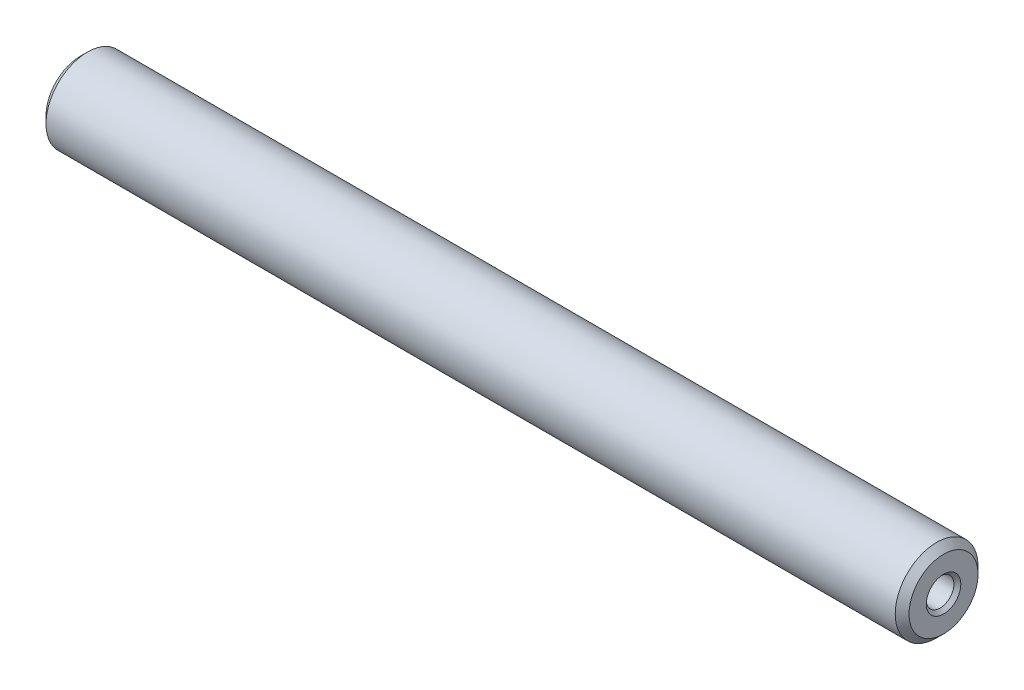
from build123d import *

# Parameters (mm, degrees)
ESQUISSE1_W                                       = 125
ESQUISSE1_H                                       = 6
CHANFREIN1_SIZE                                   = 1
DIAM_TRE_DU_PER_AGE_4_0_4_1_D                     = 4
DIAM_TRE_DU_PER_AGE_4_0_4_1_DEPTH                 = 11
DIAM_TRE_DU_PER_AGE_4_0_4_1_CSINK_D               = 5
DIAM_TRE_DU_PER_AGE_4_0_4_1_CSINK_ANGLE           = 90
DIAM_TRE_DU_PER_AGE_4_0_4_1_TIP                   = 1.201721238
DIAM_TRE_DU_PER_AGE_4_0_4_1_ON_FACE_2_D           = 4
DIAM_TRE_DU_PER_AGE_4_0_4_1_ON_FACE_2_DEPTH       = 11
DIAM_TRE_DU_PER_AGE_4_0_4_1_ON_FACE_2_CSINK_D     = 5
DIAM_TRE_DU_PER_AGE_4_0_4_1_ON_FACE_2_CSINK_ANGLE = 90
DIAM_TRE_DU_PER_AGE_4_0_4_1_ON_FACE_2_TIP         = 1.201721238


with BuildPart() as part:
    # Esquisse1 → Révolution1 (revolve)
    with BuildSketch(Plane.XY, mode=Mode.PRIVATE) as r_volution1_sk:
        with Locations((0, 3)):
            Rectangle(ESQUISSE1_W, ESQUISSE1_H)
    revolve(r_volution1_sk.sketch.rotate(Axis((-35.682971619, 0, 0), (1, 0, 0)), 90), axis=Axis((-35.682971619, 0, 0), (1, 0, 0)))

    # Chanfrein1
    chanfrein1_edges = [part.edges().sort_by_distance(p)[0] for p in [
        (62.5, 0, -6),
        (-62.5, 0, -6),
    ]]
    chamfer(chanfrein1_edges, length=CHANFREIN1_SIZE)

    # Diamètre du perçage Ø4.0 (4)1
    with Locations(Plane(origin=(62.5, 0, 0), x_dir=(0, 0, 1), z_dir=(1, 0, 0))):
        with Locations((0, 0)):
            CounterSinkHole(DIAM_TRE_DU_PER_AGE_4_0_4_1_D / 2, DIAM_TRE_DU_PER_AGE_4_0_4_1_CSINK_D / 2, depth=DIAM_TRE_DU_PER_AGE_4_0_4_1_DEPTH, counter_sink_angle=DIAM_TRE_DU_PER_AGE_4_0_4_1_CSINK_ANGLE)
            with Locations((0, 0, -(DIAM_TRE_DU_PER_AGE_4_0_4_1_DEPTH + DIAM_TRE_DU_PER_AGE_4_0_4_1_TIP / 2))):  # 118° drill point
                Cone(0, DIAM_TRE_DU_PER_AGE_4_0_4_1_D / 2, DIAM_TRE_DU_PER_AGE_4_0_4_1_TIP, mode=Mode.SUBTRACT)

    # Diamètre du perçage Ø4.0 (4)1 on face 2
    with Locations(Plane(origin=(-62.5, 0, 0), x_dir=(0, 0, -1), z_dir=(-1, 0, 0))):
        with Locations((0, 0)):
            CounterSinkHole(DIAM_TRE_DU_PER_AGE_4_0_4_1_ON_FACE_2_D / 2, DIAM_TRE_DU_PER_AGE_4_0_4_1_ON_FACE_2_CSINK_D / 2, depth=DIAM_TRE_DU_PER_AGE_4_0_4_1_ON_FACE_2_DEPTH, counter_sink_angle=DIAM_TRE_DU_PER_AGE_4_0_4_1_ON_FACE_2_CSINK_ANGLE)
            with Locations((0, 0, -(DIAM_TRE_DU_PER_AGE_4_0_4_1_ON_FACE_2_DEPTH + DIAM_TRE_DU_PER_AGE_4_0_4_1_ON_FACE_2_TIP / 2))):  # 118° drill point
                Cone(0, DIAM_TRE_DU_PER_AGE_4_0_4_1_ON_FACE_2_D / 2, DIAM_TRE_DU_PER_AGE_4_0_4_1_ON_FACE_2_TIP, mode=Mode.SUBTRACT)


solid = part.part
